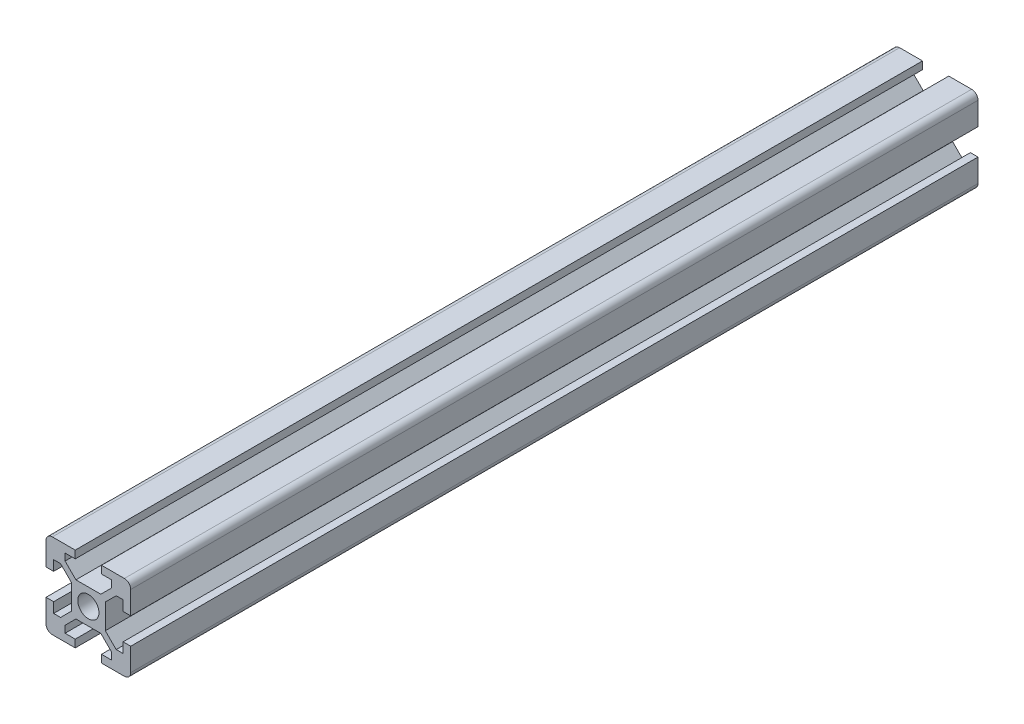
from build123d import *

# Parameters (mm, degrees)
SKETCH_1_R      = 2.5
EXTRUDE_2_DEPTH = 200
SCALE1_SCALE    = 2.5


with BuildPart() as part:
    # 草图1 → 凸台-拉伸2 (new body)
    with BuildSketch(Plane.XY):
        with BuildLine():
            Line((5.5, -8.2), (5.5, -6.560660172))
            Line((5.5, -6.560660172), (2.939339828, -4))
            Line((2.939339828, -4), (-2.939339828, -4))
            Line((-2.939339828, -4), (-5.5, -6.560660172))
            Line((-5.5, -6.560660172), (-5.5, -8.2))
            Line((-5.5, -8.2), (-3.1, -8.2))
            Line((-3.1, -8.2), (-3.1, -10))
            Line((-3.1, -10), (-8.5, -10))
            ThreePointArc((-8.5, -10), (-9.560660172, -9.560660172), (-10, -8.5))
            Line((-10, -8.5), (-10, -3.1))
            Line((-10, -3.1), (-8.2, -3.1))
            Line((-8.2, -3.1), (-8.2, -5.5))
            Line((-8.2, -5.5), (-6.560660172, -5.5))
            Line((-6.560660172, -5.5), (-4, -2.939339828))
            Line((-4, -2.939339828), (-4, 2.939339828))
            Line((-4, 2.939339828), (-6.560660172, 5.5))
            Line((-6.560660172, 5.5), (-8.2, 5.5))
            Line((-8.2, 5.5), (-8.2, 3.1))
            Line((-8.2, 3.1), (-10, 3.1))
            Line((-10, 3.1), (-10, 8.5))
            ThreePointArc((-10, 8.5), (-9.560660172, 9.560660172), (-8.5, 10))
            Line((-8.5, 10), (-3.1, 10))
            Line((-3.1, 10), (-3.1, 8.2))
            Line((-3.1, 8.2), (-5.5, 8.2))
            Line((-5.5, 8.2), (-5.5, 6.560660172))
            Line((-5.5, 6.560660172), (-2.939339828, 4))
            Line((-2.939339828, 4), (2.939339828, 4))
            Line((2.939339828, 4), (5.5, 6.560660172))
            Line((5.5, 6.560660172), (5.5, 8.2))
            Line((5.5, 8.2), (3.1, 8.2))
            Line((3.1, 8.2), (3.1, 10))
            Line((3.1, 10), (8.5, 10))
            ThreePointArc((8.5, 10), (9.560660172, 9.560660172), (10, 8.5))
            Line((10, 8.5), (10, 3.1))
            Line((10, 3.1), (8.2, 3.1))
            Line((8.2, 3.1), (8.2, 5.5))
            Line((8.2, 5.5), (6.560660172, 5.5))
            Line((6.560660172, 5.5), (4, 2.939339828))
            Line((4, 2.939339828), (4, -2.939339828))
            Line((4, -2.939339828), (6.560660172, -5.5))
            Line((6.560660172, -5.5), (8.2, -5.5))
            Line((8.2, -5.5), (8.2, -3.1))
            Line((8.2, -3.1), (10, -3.1))
            Line((10, -3.1), (10, -8.5))
            ThreePointArc((10, -8.5), (9.560660172, -9.560660172), (8.5, -10))
            Line((8.5, -10), (3.1, -10))
            Line((3.1, -10), (3.1, -8.2))
            Line((3.1, -8.2), (5.5, -8.2))
        make_face()
        Circle(SKETCH_1_R, mode=Mode.SUBTRACT)
    extrude(amount=-EXTRUDE_2_DEPTH)


with BuildPart() as part_1:
    # Scale1: scaled about (0, 0, 0)
    add(part.part.scale(SCALE1_SCALE))


solid = part_1.part
